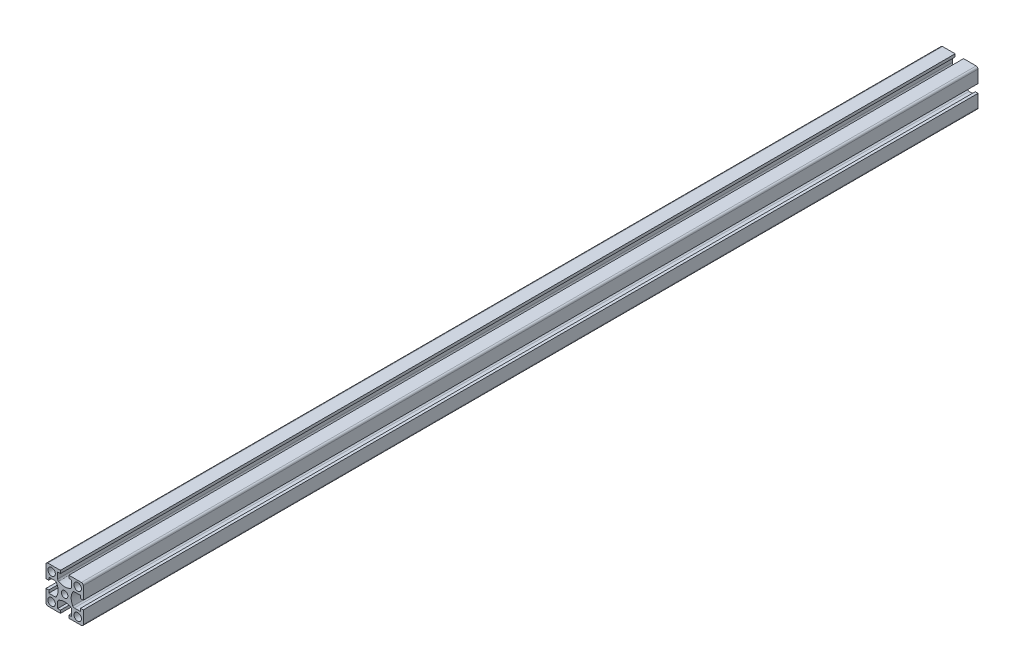
from build123d import *

# Parameters (mm, degrees)
SKETCH1_R           = 4
SKETCH1_R_2         = 3.5
BOSS_EXTRUDE1_DEPTH = 960


with BuildPart() as part:
    # Sketch1 → Boss-Extrude1 (new body)
    with BuildSketch(Plane.XY):
        with BuildLine():
            Line((-20, 18), (-20, 4.5))
            Line((-20, 4.5), (-17, 4.5))
            Line((-17, 4.5), (-17, 7.5))
            Line((-17, 7.5), (-10.473720558, 7.5))
            ThreePointArc((-10.473720558, 7.5), (-9.473720558, 7.232050808), (-8.741669751, 6.5))
            ThreePointArc((-8.741669751, 6.5), (-7, 0), (-8.741669751, -6.5))
            ThreePointArc((-8.741669751, -6.5), (-9.473720558, -7.232050808), (-10.473720558, -7.5))
            Line((-10.473720558, -7.5), (-17, -7.5))
            Line((-17, -7.5), (-17, -4.5))
            Line((-17, -4.5), (-20, -4.5))
            Line((-20, -4.5), (-20, -18))
            ThreePointArc((-20, -18), (-19.414213562, -19.414213562), (-18, -20))
            Line((-18, -20), (-4.5, -20))
            Line((-4.5, -20), (-4.5, -17))
            Line((-4.5, -17), (-7.5, -17))
            Line((-7.5, -17), (-7.5, -10.473720558))
            ThreePointArc((-7.5, -10.473720558), (-7.232050808, -9.473720558), (-6.5, -8.741669751))
            ThreePointArc((-6.5, -8.741669751), (0, -7), (6.5, -8.741669751))
            ThreePointArc((6.5, -8.741669751), (7.232050808, -9.473720558), (7.5, -10.473720558))
            Line((7.5, -10.473720558), (7.5, -17))
            Line((7.5, -17), (4.5, -17))
            Line((4.5, -17), (4.5, -20))
            Line((4.5, -20), (18, -20))
            ThreePointArc((18, -20), (19.414213562, -19.414213562), (20, -18))
            Line((20, -18), (20, -4.5))
            Line((20, -4.5), (17, -4.5))
            Line((17, -4.5), (17, -7.5))
            Line((17, -7.5), (10.473720558, -7.5))
            ThreePointArc((10.473720558, -7.5), (9.473720558, -7.232050808), (8.741669751, -6.5))
            ThreePointArc((8.741669751, -6.5), (7, 0), (8.741669751, 6.5))
            ThreePointArc((8.741669751, 6.5), (9.473720558, 7.232050808), (10.473720558, 7.5))
            Line((10.473720558, 7.5), (17, 7.5))
            Line((17, 7.5), (17, 4.5))
            Line((17, 4.5), (20, 4.5))
            Line((20, 4.5), (20, 18))
            ThreePointArc((20, 18), (19.414213562, 19.414213562), (18, 20))
            Line((18, 20), (4.5, 20))
            Line((4.5, 20), (4.5, 17))
            Line((4.5, 17), (7.5, 17))
            Line((7.5, 17), (7.5, 10.473720558))
            ThreePointArc((7.5, 10.473720558), (7.232050808, 9.473720558), (6.5, 8.741669751))
            ThreePointArc((6.5, 8.741669751), (0, 7), (-6.5, 8.741669751))
            ThreePointArc((-6.5, 8.741669751), (-7.232050808, 9.473720558), (-7.5, 10.473720558))
            Line((-7.5, 10.473720558), (-7.5, 17))
            Line((-7.5, 17), (-4.5, 17))
            Line((-4.5, 17), (-4.5, 20))
            Line((-4.5, 20), (-18, 20))
            ThreePointArc((-18, 20), (-19.414213562, 19.414213562), (-20, 18))
        make_face()
        with Locations((-14, -14)):
            Circle(SKETCH1_R, mode=Mode.SUBTRACT)
        with Locations((14, -14)):
            Circle(SKETCH1_R, mode=Mode.SUBTRACT)
        with Locations((14, 14)):
            Circle(SKETCH1_R, mode=Mode.SUBTRACT)
        Circle(SKETCH1_R_2, mode=Mode.SUBTRACT)
        with Locations((-14, 14)):
            Circle(SKETCH1_R, mode=Mode.SUBTRACT)
    extrude(amount=BOSS_EXTRUDE1_DEPTH)


solid = part.part
